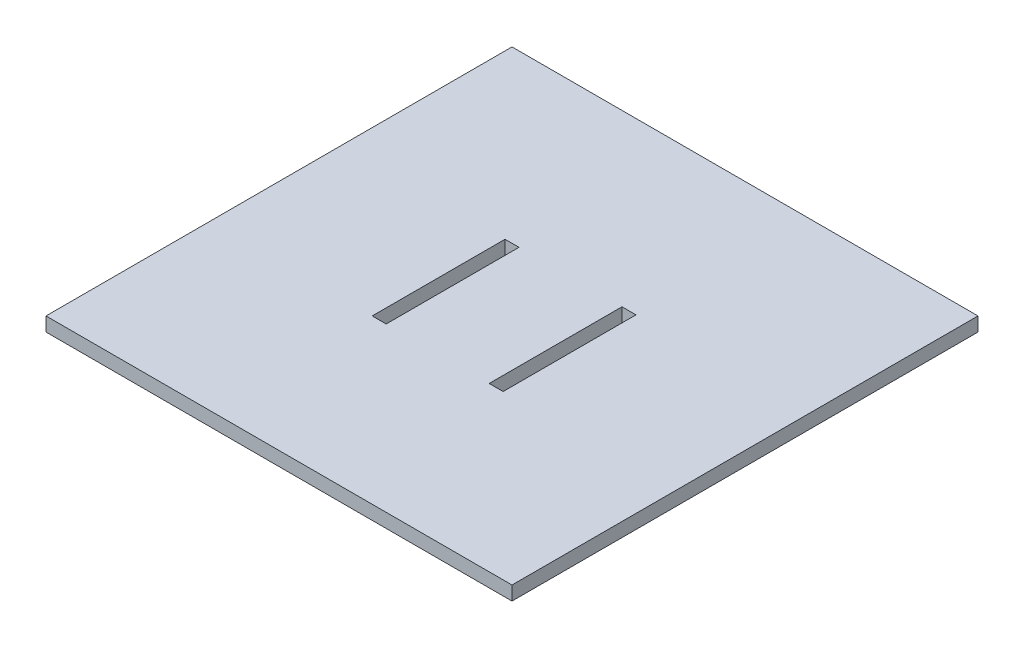
from build123d import *

# Parameters (mm, degrees)
BAIXOBASEESB_W           = 100
BAIXOBASEESB_H           = 100
BAIXOBASEESB_W_2         = 3
BAIXOBASEESB_H_2         = 28.5
RESSALTO_EXTRUS_O1_DEPTH = 3


with BuildPart() as part:
    # BaixoBaseEsb → Ressalto-extrusão1 (new body)
    with BuildSketch(Plane(origin=(0, 0, 0), x_dir=(1, 0, 0), z_dir=(0, 1, 0))):
        with Locations((50, 50)):
            Rectangle(BAIXOBASEESB_W, BAIXOBASEESB_H)
        with Locations((36.5, 49.25)):
            Rectangle(BAIXOBASEESB_W_2, BAIXOBASEESB_H_2, mode=Mode.SUBTRACT)
        with Locations((61.6, 49.25)):
            Rectangle(BAIXOBASEESB_W_2, BAIXOBASEESB_H_2, mode=Mode.SUBTRACT)
    extrude(amount=RESSALTO_EXTRUS_O1_DEPTH)


solid = part.part
